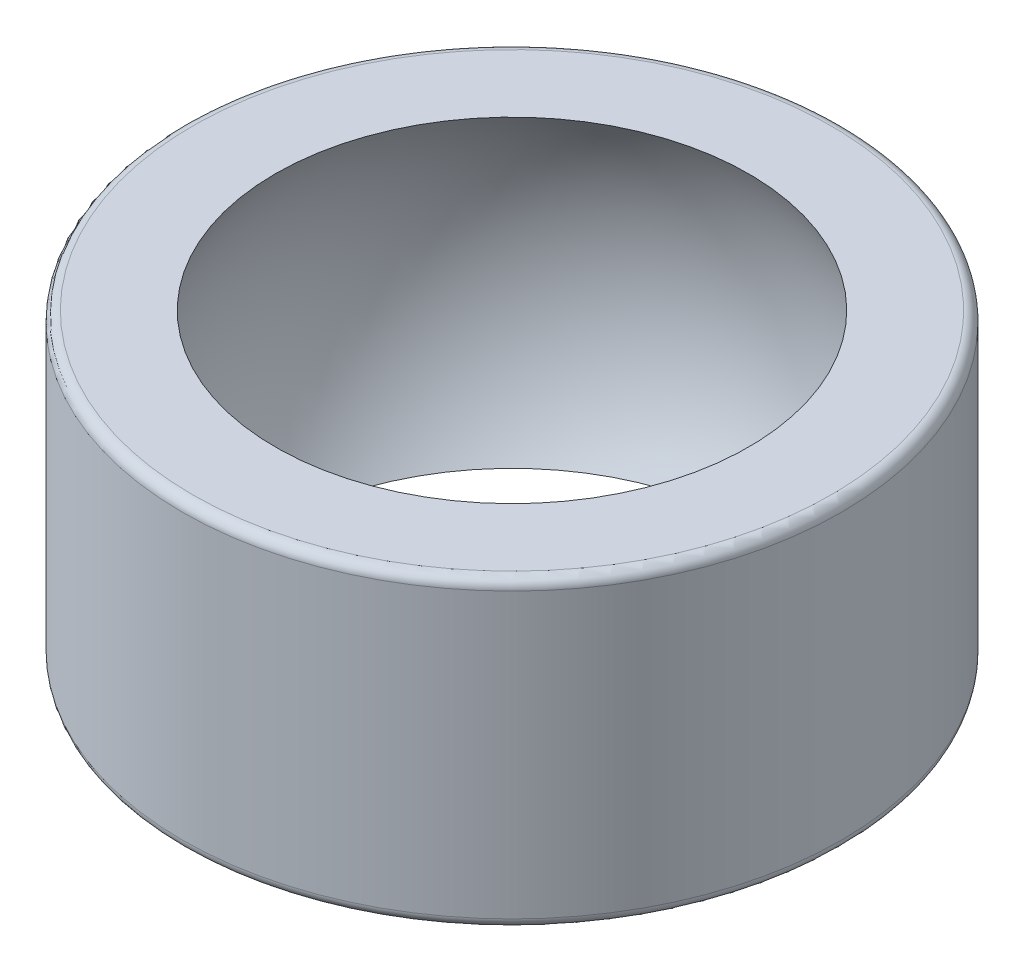
from build123d import *

# Parameters (mm, degrees)
SZKIC1_R                    = 6.5
DODANIE_WYCI_GNI_CIE1_DEPTH = 3
ZAOKR_GLENIE1_R             = 0.2


with BuildPart() as part:
    # Szkic1 → Dodanie-wyciągnięcie1 (new, symmetric)
    with BuildSketch(Plane(origin=(0, 0, 0), x_dir=(1, 0, 0), z_dir=(0, 1, 0))):
        with Locations(Location((0, 0, 0), (0, 0, 270))):
            Circle(SZKIC1_R)
    extrude(amount=DODANIE_WYCI_GNI_CIE1_DEPTH, both=True)

    # Szkic3 → Wycięcie-obrót1 (revolve, cut)
    with BuildSketch(Plane.XY):
        with BuildLine():
            Line((0, -5.55), (0, 5.55))
            ThreePointArc((0, 5.55), (5.55, 0), (0, -5.55))
        make_face()
    revolve(axis=Axis((0, -5.55, 0), (0, 1, 0)), mode=Mode.SUBTRACT)

    # Zaokrąglenie1
    zaokr_glenie1_edges = [part.edges().sort_by_distance(p)[0] for p in [
        (0, -3, -6.5),
        (0, 3, -6.5),
    ]]
    fillet(zaokr_glenie1_edges, radius=ZAOKR_GLENIE1_R)


solid = part.part
